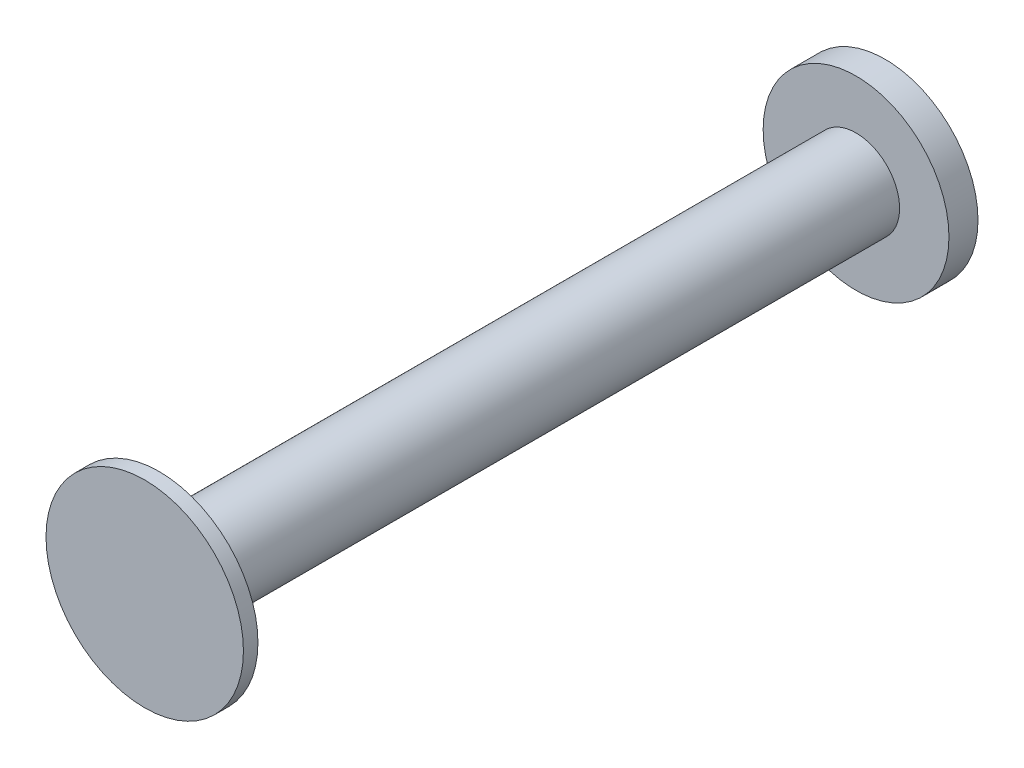
from build123d import *

# Parameters (mm, degrees)
SKETCH1_R           = 20.32
BOSS_EXTRUDE1_DEPTH = 6.35
SKETCH2_R           = 9.525
BOSS_EXTRUDE2_DEPTH = 152.4
SKETCH3_R           = 21.59
BOSS_EXTRUDE3_DEPTH = 3.175


with BuildPart() as part:
    # Sketch1 → Boss-Extrude1 (new body)
    with BuildSketch(Plane.XY):
        Circle(SKETCH1_R)
    extrude(amount=BOSS_EXTRUDE1_DEPTH)

    # Sketch2 → Boss-Extrude2 (add)
    with BuildSketch(Plane.XY.offset(6.35)):
        with Locations(Location((0, 0, 0), (0, 0, 180))):
            Circle(SKETCH2_R)
    extrude(amount=BOSS_EXTRUDE2_DEPTH)

    # Sketch3 → Boss-Extrude3 (add)
    with BuildSketch(Plane.XY.offset(158.75)):
        Circle(SKETCH3_R)
    extrude(amount=BOSS_EXTRUDE3_DEPTH)


solid = part.part
